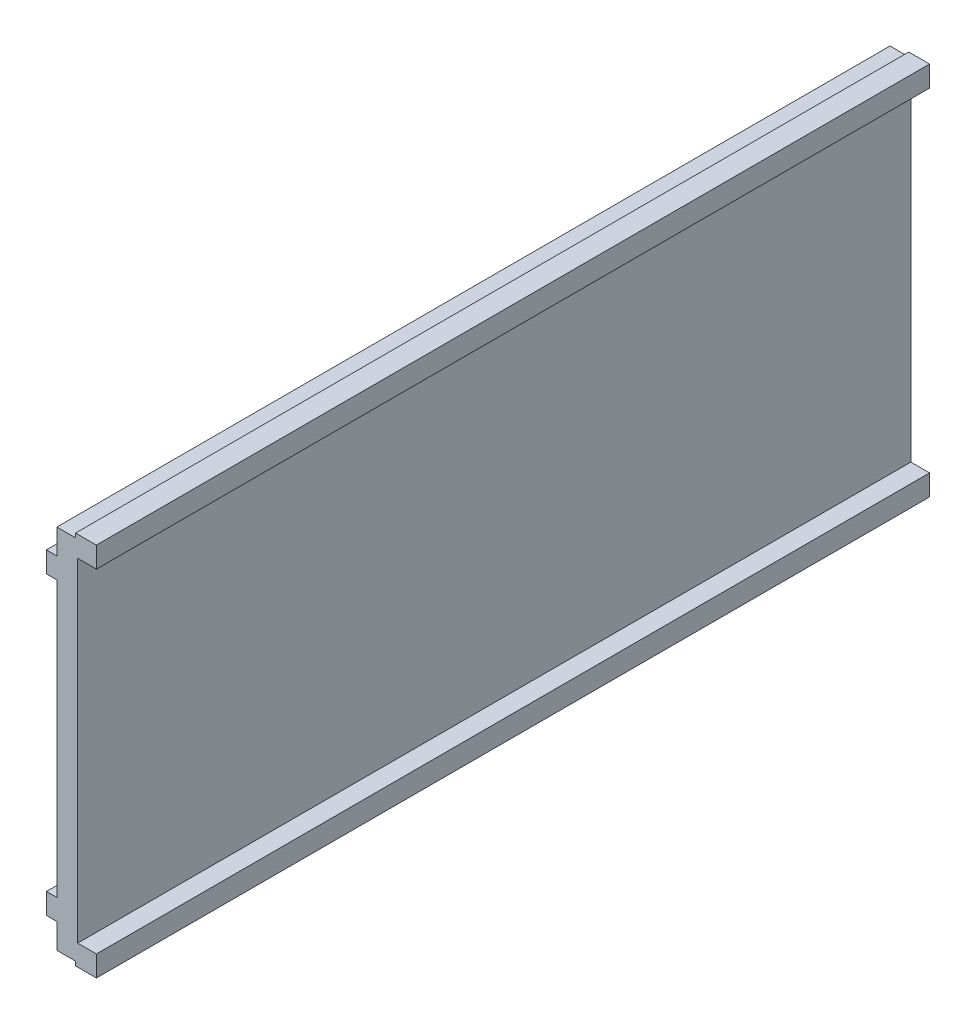
from build123d import *

# Parameters (mm, degrees)
BOSS_EXTRUDE1_DEPTH = 200


with BuildPart() as part:
    # Sketch1 → Boss-Extrude1 (new body)
    with BuildSketch(Plane.XY):
        Polygon((-46.041883504, -5.20889143), (-46.041883504, -6.20889143), (-50.541883504, -6.20889143), (-50.541883504, -12.20889143), (-53.041883504, -12.20889143), (-53.041883504, -17.20889143), (-50.541883504, -17.20889143), (-50.541883504, -83.20889143), (-53.041883504, -83.20889143), (-53.041883504, -88.20889143), (-50.541883504, -88.20889143), (-50.541883504, -94.20889143), (-46.041883504, -94.20889143), (-46.041883504, -95.20889143), (-41.041883504, -95.20889143), (-41.041883504, -90.20889143), (-45.541883504, -90.20889143), (-45.541883504, -10.20889143), (-41.041883504, -10.20889143), (-41.041883504, -5.20889143), align=None)
    extrude(amount=BOSS_EXTRUDE1_DEPTH)


solid = part.part
